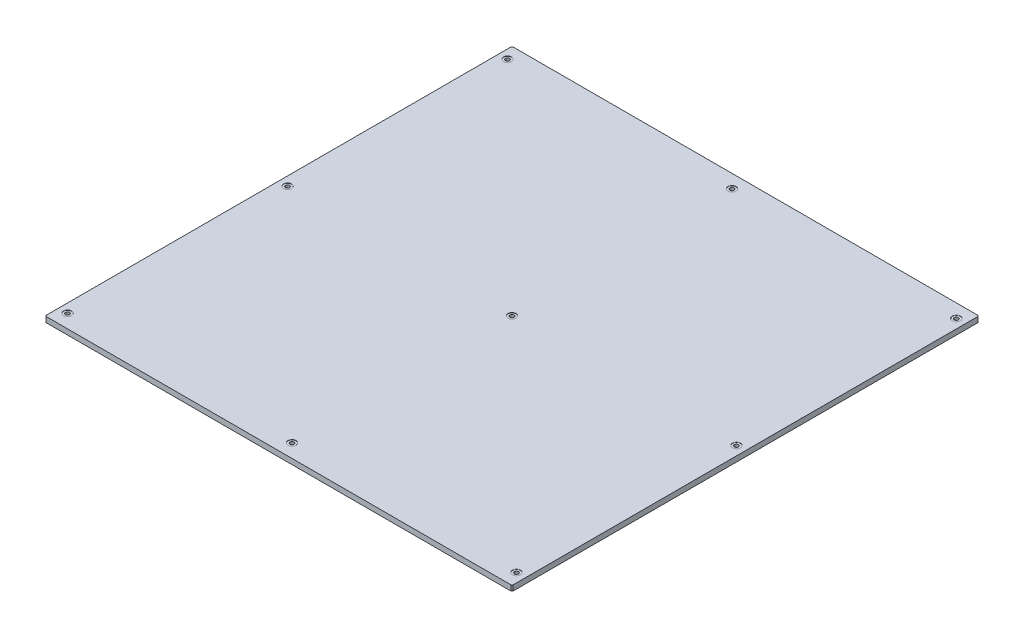
from build123d import *

# Parameters (mm, degrees)
SKETCH_1_W                  = 1040
SKETCH_1_H                  = 1040
EXTRUDE_1_DEPTH             = 12
CHAMFER_1_SIZE              = 2
HOLE_WIZARD_M8_1_AT_2_COUNT = 2
HOLE_WIZARD_M8_1_AT_2_PITCH = 500
HOLE_WIZARD_M8_1_AT_3_COUNT = 2
HOLE_WIZARD_M8_1_AT_3_PITCH = 1000
HOLE_WIZARD_M8_1_AT_4_COUNT = 2
HOLE_WIZARD_M8_1_AT_4_PITCH = 490
HOLE_WIZARD_M8_1_AT_5_COUNT = 2
HOLE_WIZARD_M8_1_AT_5_PITCH = 700.071424927
HOLE_WIZARD_M8_1_AT_6_COUNT = 2
HOLE_WIZARD_M8_1_AT_6_PITCH = 1113.597772986
HOLE_WIZARD_M8_1_AT_7_COUNT = 2
HOLE_WIZARD_M8_1_AT_7_PITCH = 980
HOLE_WIZARD_M8_1_AT_8_COUNT = 2
HOLE_WIZARD_M8_1_AT_8_PITCH = 1100.181803158
HOLE_WIZARD_M8_1_AT_9_COUNT = 2
HOLE_WIZARD_M8_1_AT_9_PITCH = 1400.142849855


with BuildPart() as part:
    # 草图1 → 凸台-拉伸1 (new body)
    with BuildSketch(Plane(origin=(0, 0, 0), x_dir=(1, 0, 0), z_dir=(0, 1, 0))):
        Rectangle(SKETCH_1_W, SKETCH_1_H)
    extrude(amount=EXTRUDE_1_DEPTH)

    # 倒角1
    chamfer_1_edges = [part.edges().sort_by_distance(p)[0] for p in [
        (520, 6, 520),
        (-520, 6, 520),
        (-520, 6, -520),
        (520, 6, -520),
    ]]
    chamfer(chamfer_1_edges, length=CHAMFER_1_SIZE)

    # 草图3 → M8 六角头螺栓的柱形沉头孔1 (revolve, cut)
    with BuildSketch(Plane(origin=(-500, 12, -490), x_dir=(0, 0, 1), z_dir=(1, 0, 0))):
        Polygon((0, 0), (0, 12), (4.5, 12), (4.5, 0.5), (9, 0.5), (9, 0.025), (9.025, 0), align=None)
    hole_wizard_m8_1 = revolve(axis=Axis((-500, 18.35, -490), (0, -1, 0)), mode=Mode.SUBTRACT)

    # M8 六角头螺栓的柱形沉头孔1 at 2: M8 六角头螺栓的柱形沉头孔1 ×2
    with Locations(*[(i * HOLE_WIZARD_M8_1_AT_2_PITCH, 0, 0) for i in range(1, HOLE_WIZARD_M8_1_AT_2_COUNT)]):
        add(hole_wizard_m8_1, mode=Mode.SUBTRACT)

    # M8 六角头螺栓的柱形沉头孔1 at 3: M8 六角头螺栓的柱形沉头孔1 ×2
    with Locations(*[(i * HOLE_WIZARD_M8_1_AT_3_PITCH, 0, 0) for i in range(1, HOLE_WIZARD_M8_1_AT_3_COUNT)]):
        add(hole_wizard_m8_1, mode=Mode.SUBTRACT)

    # M8 六角头螺栓的柱形沉头孔1 at 4: M8 六角头螺栓的柱形沉头孔1 ×2
    with Locations(*[(0, 0, i * HOLE_WIZARD_M8_1_AT_4_PITCH) for i in range(1, HOLE_WIZARD_M8_1_AT_4_COUNT)]):
        add(hole_wizard_m8_1, mode=Mode.SUBTRACT)

    # M8 六角头螺栓的柱形沉头孔1 at 5: M8 六角头螺栓的柱形沉头孔1 ×2
    with Locations(*[Vector(0.7142128391425069, 0, 0.6999285823596574) * (i * HOLE_WIZARD_M8_1_AT_5_PITCH) for i in range(1, HOLE_WIZARD_M8_1_AT_5_COUNT)]):
        add(hole_wizard_m8_1, mode=Mode.SUBTRACT)

    # M8 六角头螺栓的柱形沉头孔1 at 6: M8 六角头螺栓的柱形沉头孔1 ×2
    with Locations(*[Vector(0.8979903015775171, 0, 0.44001524777298334) * (i * HOLE_WIZARD_M8_1_AT_6_PITCH) for i in range(1, HOLE_WIZARD_M8_1_AT_6_COUNT)]):
        add(hole_wizard_m8_1, mode=Mode.SUBTRACT)

    # M8 六角头螺栓的柱形沉头孔1 at 7: M8 六角头螺栓的柱形沉头孔1 ×2
    with Locations(*[(0, 0, i * HOLE_WIZARD_M8_1_AT_7_PITCH) for i in range(1, HOLE_WIZARD_M8_1_AT_7_COUNT)]):
        add(hole_wizard_m8_1, mode=Mode.SUBTRACT)

    # M8 六角头螺栓的柱形沉头孔1 at 8: M8 六角头螺栓的柱形沉头孔1 ×2
    with Locations(*[Vector(0.4544703416878743, 0, 0.8907618697082328) * (i * HOLE_WIZARD_M8_1_AT_8_PITCH) for i in range(1, HOLE_WIZARD_M8_1_AT_8_COUNT)]):
        add(hole_wizard_m8_1, mode=Mode.SUBTRACT)

    # M8 六角头螺栓的柱形沉头孔1 at 9: M8 六角头螺栓的柱形沉头孔1 ×2
    with Locations(*[Vector(0.7142128391425073, 0, 0.6999285823596569) * (i * HOLE_WIZARD_M8_1_AT_9_PITCH) for i in range(1, HOLE_WIZARD_M8_1_AT_9_COUNT)]):
        add(hole_wizard_m8_1, mode=Mode.SUBTRACT)


solid = part.part
